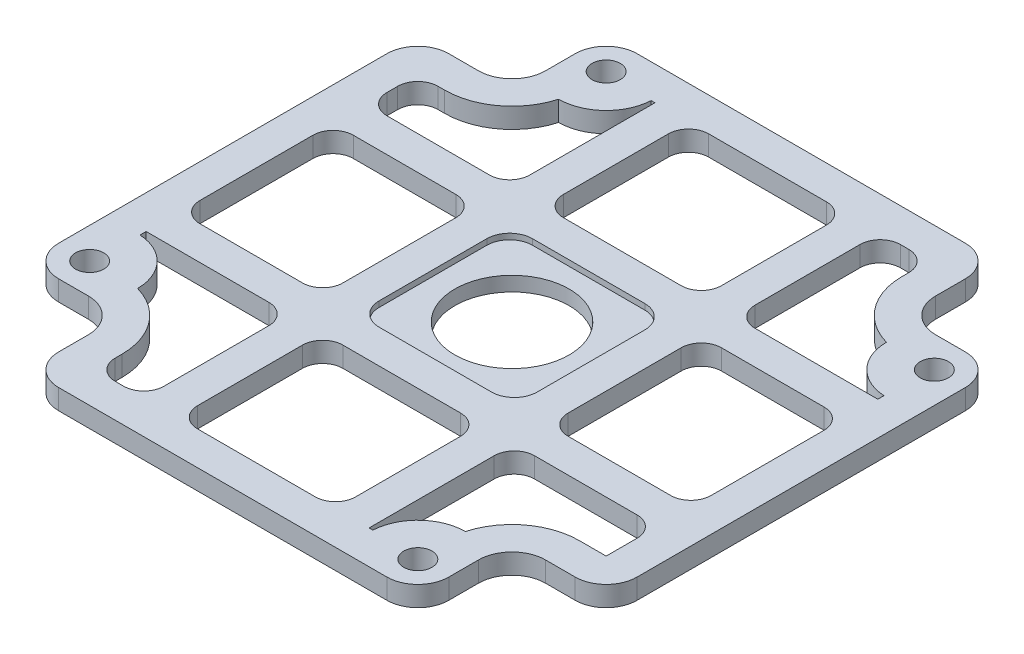
from build123d import *

# Parameters (mm, degrees)
SKETCH1_W           = 86
SKETCH1_H           = 86
BOSS_EXTRUDE1_DEPTH = 3
SKETCH2_R           = 8.5
SKETCH2_W           = 14
SKETCH2_H           = 14
CUT_EXTRUDE1_DEPTH  = 61.88513776
FILLET1_R           = 4.6
FILLET2_R           = 5
SKETCH3_R           = 2.1
CUT_EXTRUDE2_DEPTH  = 61.88513776
SKETCH4_W           = 23.5
SKETCH4_H           = 22.8
SKETCH4_R           = 8.5
CUT_EXTRUDE3_DEPTH  = 0.85
FILLET3_R           = 3.4
SKETCH5_W           = 23.5
SKETCH5_H           = 14
SKETCH5_H_2         = 7.6
SKETCH5_W_2         = 14
SKETCH5_H_3         = 22.8
SKETCH5_W_3         = 7.25
CUT_EXTRUDE4_DEPTH  = 61.88513776
FILLET4_R           = 3


with BuildPart() as part:
    # Sketch1 → Boss-Extrude1 (new body)
    with BuildSketch(Plane(origin=(0, 0, 0), x_dir=(1, 0, 0), z_dir=(0, 1, 0))):
        Rectangle(SKETCH1_W, SKETCH1_H)
    extrude(amount=BOSS_EXTRUDE1_DEPTH)

    # Sketch2 → Cut-Extrude1 (cut, through all)
    with BuildSketch(Plane(origin=(0, 3, 0), x_dir=(1, 0, 0), z_dir=(0, 1, 0))):
        with Locations(Location((0, 0, 0), (0, 0, 270))):
            Circle(SKETCH2_R)
        with Locations((36, 36)):
            Rectangle(SKETCH2_W, SKETCH2_H)
        with Locations((-36, 36)):
            Rectangle(SKETCH2_W, SKETCH2_H)
        with Locations((36, -36)):
            Rectangle(SKETCH2_W, SKETCH2_H)
        with Locations((-36, -36)):
            Rectangle(SKETCH2_W, SKETCH2_H)
    extrude(amount=-CUT_EXTRUDE1_DEPTH, mode=Mode.SUBTRACT)

    # Fillet1
    fillet1_edges = [part.edges().sort_by_distance(p)[0] for p in [
        (-43, 1.5, 29),
        (-29, 1.5, 43),
        (43, 1.5, 29),
        (29, 1.5, 43),
        (29, 1.5, -43),
        (43, 1.5, -29),
        (-43, 1.5, -29),
        (-29, 1.5, -43),
    ]]
    fillet(fillet1_edges, radius=FILLET1_R)

    # Fillet2
    fillet2_edges = [part.edges().sort_by_distance(p)[0] for p in [
        (-29, 1.5, 29),
        (29, 1.5, 29),
        (29, 1.5, -29),
        (-29, 1.5, -29),
    ]]
    fillet(fillet2_edges, radius=FILLET2_R)

    # Sketch3 → Cut-Extrude2 (cut, through all)
    with BuildSketch(Plane(origin=(0, 3, 0), x_dir=(1, 0, 0), z_dir=(0, 1, 0))):
        with Locations(Location((38.4, 24.4, 0), (0, 0, 270))):
            Circle(SKETCH3_R)
        with Locations(Location((-24.4, 38.4, 0), (0, 0, 270))):
            Circle(SKETCH3_R)
        with Locations(Location((24.4, -38.4, 0), (0, 0, 270))):
            Circle(SKETCH3_R)
        with Locations(Location((-38.4, -24.4, 0), (0, 0, 270))):
            Circle(SKETCH3_R)
    extrude(amount=-CUT_EXTRUDE2_DEPTH, mode=Mode.SUBTRACT)

    # Sketch4 → Cut-Extrude3 (cut)
    with BuildSketch(Plane(origin=(0, 3, 0), x_dir=(1, 0, 0), z_dir=(0, 1, 0))):
        Rectangle(SKETCH4_W, SKETCH4_H)
        with Locations(Location((0, 0, 0), (0, 0, 270))):
            Circle(SKETCH4_R, mode=Mode.SUBTRACT)
    extrude(amount=-CUT_EXTRUDE3_DEPTH, mode=Mode.SUBTRACT)

    # Fillet3
    fillet3_edges = [part.edges().sort_by_distance(p)[0] for p in [
        (-11.75, 2.575, 11.4),
        (-11.75, 2.575, -11.4),
        (11.75, 2.575, -11.4),
        (11.75, 2.575, 11.4),
    ]]
    fillet(fillet3_edges, radius=FILLET3_R)

    # Sketch5 → Cut-Extrude4 (cut, through all)
    with BuildSketch(Plane(origin=(0, 3, 0), x_dir=(1, 0, 0), z_dir=(0, 1, 0))):
        with Locations((0, 31)):
            Rectangle(SKETCH5_W, SKETCH5_H)
        with Locations((0, 20.2)):
            Rectangle(SKETCH5_W, SKETCH5_H_2)
        with Locations((-31, 0)):
            Rectangle(SKETCH5_W_2, SKETCH5_H_3)
        with Locations((-20.375, 0)):
            Rectangle(SKETCH5_W_3, SKETCH5_H_3)
        with Locations((31, 0)):
            Rectangle(SKETCH5_W_2, SKETCH5_H_3)
        with Locations((20.375, 0)):
            Rectangle(SKETCH5_W_3, SKETCH5_H_3)
        with Locations((0, -20.2)):
            Rectangle(SKETCH5_W, SKETCH5_H_2)
        with Locations((0, -31)):
            Rectangle(SKETCH5_W, SKETCH5_H)
        with Locations((20.375, -20.2)):
            Rectangle(SKETCH5_W_3, SKETCH5_H_2)
        Polygon((24, -16.4), (24, -24), (34, -24), (38, -24), (38, -16.4), align=None)
        with BuildLine():
            Line((24, -24), (16.75, -24))
            Line((16.75, -24), (16.75, -38))
            Line((16.75, -38), (17.311276561, -38))
            ThreePointArc((17.311276561, -38), (19.379541854, -33.379541854), (24, -31.311276561))
            Line((24, -31.311276561), (24, -24))
        make_face()
        with BuildLine():
            Line((34, -24), (24, -24))
            Line((24, -24), (24, -31.311276561))
            ThreePointArc((24, -31.311276561), (24.185616902, -31.303237366), (24.371380604, -31.300057681))
            ThreePointArc((24.371380604, -31.300057681), (27.958453145, -26.031329371), (34, -24))
        make_face()
        Polygon((-16.75, -24), (-24, -24), (-24, -34), (-24, -38), (-16.75, -38), align=None)
        with Locations((-20.375, -20.2)):
            Rectangle(SKETCH5_W_3, SKETCH5_H_2)
        with BuildLine():
            Line((-24, -24), (-24, -16.4))
            Line((-24, -16.4), (-38, -16.4))
            Line((-38, -16.4), (-38, -17.311276561))
            ThreePointArc((-38, -17.311276561), (-33.379541854, -19.379541854), (-31.311276561, -24))
            Line((-31.311276561, -24), (-24, -24))
        make_face()
        with BuildLine():
            Line((-24, -34), (-24, -24))
            Line((-24, -24), (-31.311276561, -24))
            ThreePointArc((-31.311276561, -24), (-31.303237366, -24.185616902), (-31.300057681, -24.371380604))
            ThreePointArc((-31.300057681, -24.371380604), (-26.031329371, -27.958453145), (-24, -34))
        make_face()
        Polygon((-38, 16.4), (-24, 16.4), (-24, 24), (-34, 24), (-38, 24), align=None)
        with BuildLine():
            Line((-24, 31.311276561), (-24, 24))
            Line((-24, 24), (-16.75, 24))
            Line((-16.75, 24), (-16.75, 38))
            Line((-16.75, 38), (-17.311276561, 38))
            ThreePointArc((-17.311276561, 38), (-19.379541854, 33.379541854), (-24, 31.311276561))
        make_face()
        with Locations((-20.375, 20.2)):
            Rectangle(SKETCH5_W_3, SKETCH5_H_2)
        with BuildLine():
            Line((-34, 24), (-24, 24))
            Line((-24, 24), (-24, 31.311276561))
            ThreePointArc((-24, 31.311276561), (-24.185616902, 31.303237366), (-24.371380604, 31.300057681))
            ThreePointArc((-24.371380604, 31.300057681), (-27.958453145, 26.031329371), (-34, 24))
        make_face()
        Polygon((16.75, 38), (16.75, 24), (24, 24), (24, 34), (24, 38), align=None)
        with Locations((20.375, 20.2)):
            Rectangle(SKETCH5_W_3, SKETCH5_H_2)
        with BuildLine():
            Line((31.311276561, 24), (24, 24))
            Line((24, 24), (24, 16.4))
            Line((24, 16.4), (38, 16.4))
            Line((38, 16.4), (38, 17.311276561))
            ThreePointArc((38, 17.311276561), (33.379541854, 19.379541854), (31.311276561, 24))
        make_face()
        with BuildLine():
            Line((24, 34), (24, 24))
            Line((24, 24), (31.311276561, 24))
            ThreePointArc((31.311276561, 24), (31.303237366, 24.185616902), (31.300057681, 24.371380604))
            ThreePointArc((31.300057681, 24.371380604), (26.031329371, 27.958453145), (24, 34))
        make_face()
    extrude(amount=-CUT_EXTRUDE4_DEPTH, mode=Mode.SUBTRACT)

    # Fillet4
    fillet4_edges = [part.edges().sort_by_distance(p)[0] for p in [
        (-16.75, 1.5, 11.4),
        (-38, 1.5, 11.4),
        (-38, 1.5, -11.4),
        (-16.75, 1.5, -11.4),
        (16.75, 1.5, -11.4),
        (38, 1.5, -11.4),
        (38, 1.5, 11.4),
        (16.75, 1.5, 11.4),
        (-11.75, 1.5, 38),
        (-11.75, 1.5, 16.4),
        (11.75, 1.5, 16.4),
        (11.75, 1.5, 38),
        (16.75, 1.5, 16.4),
        (38, 1.5, 16.4),
        (-16.75, 1.5, 16.4),
        (-16.75, 1.5, 38),
        (-24, 1.5, 38),
        (-38, 1.5, -24),
        (-16.75, 1.5, -16.4),
        (-38, 1.5, -16.4),
        (16.75, 1.5, -16.4),
        (16.75, 1.5, -38),
        (24, 1.5, -38),
        (-11.75, 1.5, -16.4),
        (-11.75, 1.5, -38),
        (11.75, 1.5, -38),
        (11.75, 1.5, -16.4),
    ]]
    fillet(fillet4_edges, radius=FILLET4_R)


solid = part.part
